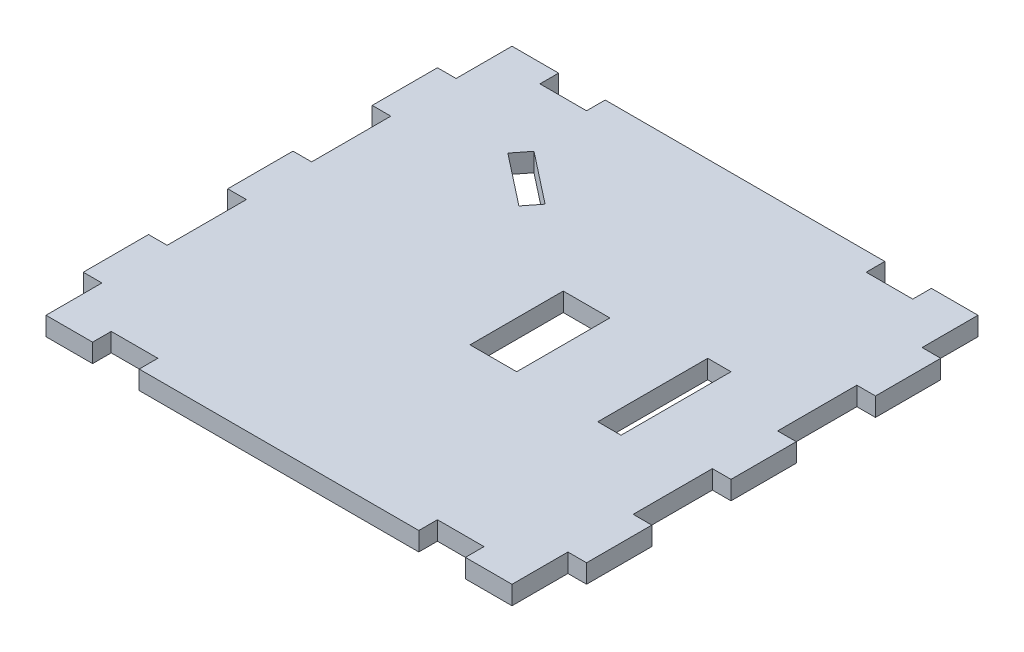
from build123d import *

# Parameters (mm, degrees)
SKETCH1_W           = 50
SKETCH1_H           = 50
SKETCH1_W_2         = 2.5
SKETCH1_H_2         = 11.8
SKETCH1_W_3         = 2
SKETCH1_H_3         = 7
BOSS_EXTRUDE1_DEPTH = 2
SKETCH3_W           = 5
SKETCH3_H           = 2
CUT_EXTRUDE1_DEPTH  = 2
SKETCH4_W           = 5
SKETCH4_H           = 10
CUT_EXTRUDE2_DEPTH  = 2
CUT_EXTRUDE3_DEPTH  = 2


with BuildPart() as part:
    # Sketch1 → Boss-Extrude1 (new body)
    # profile 1 of 7: a face of its own
    with BuildSketch(Plane(origin=(0, 0, 0), x_dir=(1, 0, 0), z_dir=(0, 1, 0))):
        Rectangle(SKETCH1_W, SKETCH1_H)
        with Locations((15.75, 0.6)):
            Rectangle(SKETCH1_W_2, SKETCH1_H_2, mode=Mode.SUBTRACT)
    # profile 2 of 7: a face of its own
    with BuildSketch(Plane(origin=(0, 0, 0), x_dir=(1, 0, 0), z_dir=(0, 1, 0))):
        with Locations((26, 0)):
            Rectangle(SKETCH1_W_3, SKETCH1_H_3)
    # profile 3 of 7: a face of its own
    with BuildSketch(Plane(origin=(0, 0, 0), x_dir=(1, 0, 0), z_dir=(0, 1, 0))):
        with Locations((26, 15.5)):
            Rectangle(SKETCH1_W_3, SKETCH1_H_3)
    # profile 4 of 7: a face of its own
    with BuildSketch(Plane(origin=(0, 0, 0), x_dir=(1, 0, 0), z_dir=(0, 1, 0))):
        with Locations((26, -15.5)):
            Rectangle(SKETCH1_W_3, SKETCH1_H_3)
    # profile 5 of 7: a face of its own
    with BuildSketch(Plane(origin=(0, 0, 0), x_dir=(1, 0, 0), z_dir=(0, 1, 0))):
        with Locations((-26, 0)):
            Rectangle(SKETCH1_W_3, SKETCH1_H_3)
    # profile 6 of 7: a face of its own
    with BuildSketch(Plane(origin=(0, 0, 0), x_dir=(1, 0, 0), z_dir=(0, 1, 0))):
        with Locations((-26, -15.5)):
            Rectangle(SKETCH1_W_3, SKETCH1_H_3)
    # profile 7 of 7: a face of its own
    with BuildSketch(Plane(origin=(0, 0, 0), x_dir=(1, 0, 0), z_dir=(0, 1, 0))):
        with Locations((-26, 15.5)):
            Rectangle(SKETCH1_W_3, SKETCH1_H_3)
    extrude(amount=BOSS_EXTRUDE1_DEPTH)

    # Sketch3 → Cut-Extrude1 (cut)
    with BuildSketch(Plane(origin=(0, 2, 0), x_dir=(1, 0, 0), z_dir=(0, 1, 0))):
        with Locations((17.5, 24)):
            Rectangle(SKETCH3_W, SKETCH3_H)
        with Locations((17.5, -24)):
            Rectangle(SKETCH3_W, SKETCH3_H)
        with Locations((-17.5, 24)):
            Rectangle(SKETCH3_W, SKETCH3_H)
        with Locations((-17.5, -24)):
            Rectangle(SKETCH3_W, SKETCH3_H)
    extrude(amount=-CUT_EXTRUDE1_DEPTH, mode=Mode.SUBTRACT)

    # Sketch4 → Cut-Extrude2 (cut)
    with BuildSketch(Plane(origin=(0, 2, 0), x_dir=(1, 0, 0), z_dir=(0, 1, 0))):
        with Locations((3, 0)):
            Rectangle(SKETCH4_W, SKETCH4_H)
    extrude(amount=-CUT_EXTRUDE2_DEPTH, mode=Mode.SUBTRACT)

    # Sketch5 → Cut-Extrude3 (cut)
    with BuildSketch(Plane(origin=(0, 2, 0), x_dir=(1, 0, 0), z_dir=(0, 1, 0))):
        Polygon((-14.056788221, 16.417088801), (-8.5488143, 12.097109255), (-9.78309417, 10.52340242), (-15.291068091, 14.843381966), align=None)
    extrude(amount=-CUT_EXTRUDE3_DEPTH, mode=Mode.SUBTRACT)


solid = part.part
